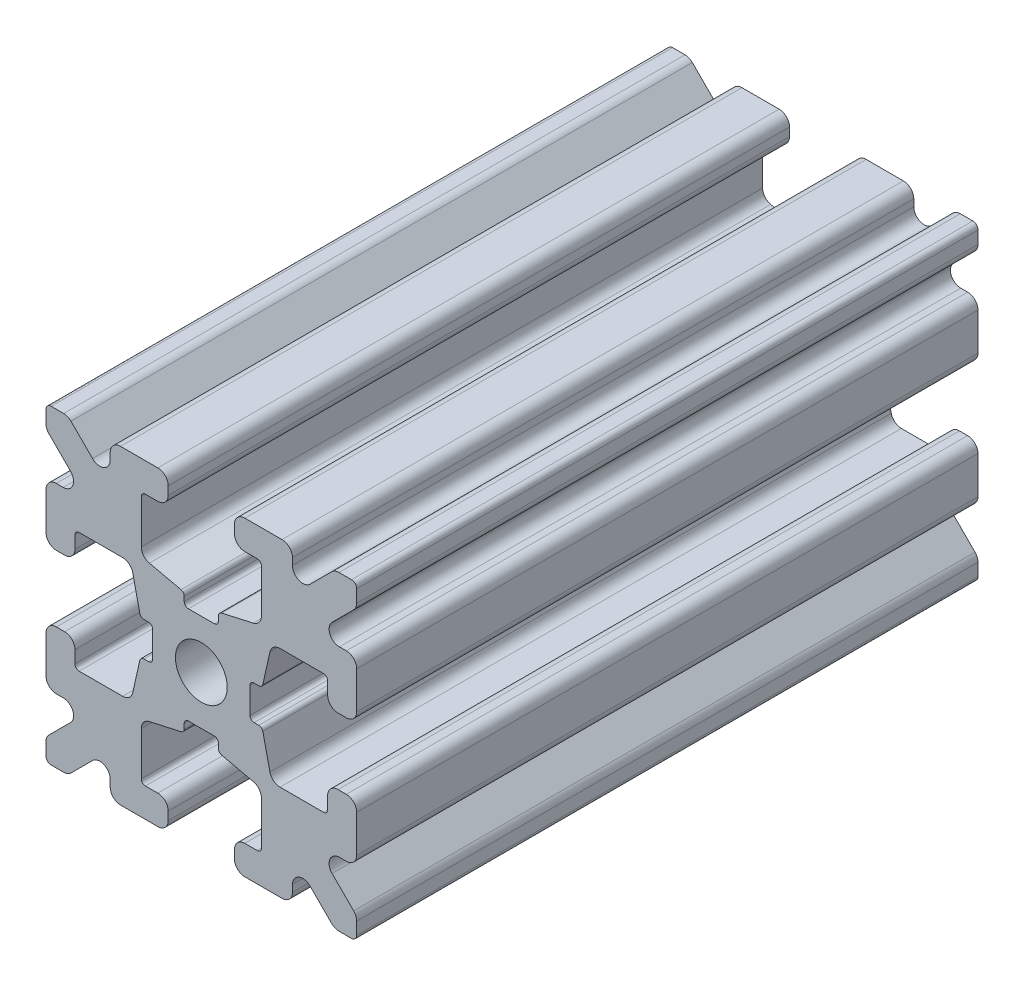
from build123d import *

# Parameters (mm, degrees)
SKETCH1_W           = 15
SKETCH1_H           = 15
SKETCH1_R           = 1.25
BOSS_EXTRUDE1_DEPTH = 15
FILLET1_R           = 0.25
CUT_EXTRUDE1_DEPTH  = 32.819805153
CUT_EXTRUDE3_DEPTH  = 32.819805153
FILLET3_R           = 0.5
FILLET4_R           = 0.5
FILLET5_R           = 3
FILLET6_R           = 0.2
CUT_EXTRUDE4_DEPTH  = 32.819805153
FILLET8_R           = 0.5
SKETCH6_W           = 5.1529354
SKETCH6_H           = 1.651
SKETCH6_W_2         = 1.651
SKETCH6_H_2         = 5.1529354
CUT_EXTRUDE5_DEPTH  = 32.819805153
FILLET10_R          = 0.2


with BuildPart() as part:
    # Sketch1 → Boss-Extrude1 (new, symmetric)
    with BuildSketch(Plane.XY):
        Rectangle(SKETCH1_W, SKETCH1_H)
        Circle(SKETCH1_R, mode=Mode.SUBTRACT)
    extrude(amount=BOSS_EXTRUDE1_DEPTH, both=True)

    # Fillet1
    fillet1_edges = [part.edges().sort_by_distance(p)[0] for p in [
        (7.5, -7.5, 0),
        (-7.5, -7.5, 0),
        (-7.5, 7.5, 0),
        (7.5, 7.5, 0),
    ]]
    fillet(fillet1_edges, radius=FILLET1_R)

    # Sketch2 → Cut-Extrude1 (cut, through all)
    with BuildSketch(Plane.XY.offset(15)):
        Polygon((-7.5, 1.6), (-6.1, 1.6), (-6.1, 2.9), (-3.4, 2.9), (-3.4, -2.9), (-6.1, -2.9), (-6.1, -1.6), (-7.5, -1.6), align=None)
        Polygon((2.9, 6.1), (1.6, 6.1), (1.6, 7.5), (-1.6, 7.5), (-1.6, 6.1), (-2.9, 6.1), (-2.9, 3.4), (2.9, 3.4), align=None)
        Polygon((-1.6, -7.5), (-1.6, -6.1), (-2.9, -6.1), (-2.9, -3.4), (2.9, -3.4), (2.9, -6.1), (1.6, -6.1), (1.6, -7.5), align=None)
        Polygon((6.1, -2.9), (6.1, -1.6), (7.5, -1.6), (7.5, 1.6), (6.1, 1.6), (6.1, 2.9), (3.4, 2.9), (3.4, -2.9), align=None)
    extrude(amount=-CUT_EXTRUDE1_DEPTH, mode=Mode.SUBTRACT)

    # Sketch4 → Cut-Extrude3 (cut, through all)
    with BuildSketch(Plane.XY.offset(15)):
        Polygon((-3.4, 2.9), (-2.75, 0), (-3.4, -2.9), align=None)
        Polygon((-2.9, 3.4), (0, 2.75), (2.9, 3.4), align=None)
        Polygon((3.4, 2.9), (2.75, 0), (3.4, -2.9), align=None)
        Polygon((-2.9, -3.4), (0, -2.75), (2.9, -3.4), align=None)
    extrude(amount=-CUT_EXTRUDE3_DEPTH, mode=Mode.SUBTRACT)

    # Fillet3
    fillet3_edges = [part.edges().sort_by_distance(p)[0] for p in [
        (1.6, -7.5, 0),
        (-1.6, -7.5, 0),
        (-1.6, -6.1, 0),
        (1.6, -6.1, 0),
        (6.1, 1.6, 0),
        (7.5, 1.6, 0),
        (7.5, -1.6, 0),
        (6.1, -1.6, 0),
        (-7.5, -1.6, 0),
        (-7.5, 1.6, 0),
        (-6.1, 1.6, 0),
        (-6.1, -1.6, 0),
        (-1.6, 6.1, 0),
        (-1.6, 7.5, 0),
        (1.6, 7.5, 0),
        (1.6, 6.1, 0),
    ]]
    fillet(fillet3_edges, radius=FILLET3_R)

    # Fillet4
    fillet4_edges = [part.edges().sort_by_distance(p)[0] for p in [
        (-2.9, -3.4, 0),
        (2.9, -3.4, 0),
        (3.4, -2.9, 0),
        (3.4, 2.9, 0),
        (-3.4, 2.9, 0),
        (-3.4, -2.9, 0),
        (2.9, 3.4, 0),
        (-2.9, 3.4, 0),
    ]]
    fillet(fillet4_edges, radius=FILLET4_R)

    # Fillet5
    fillet5_edges = [part.edges().sort_by_distance(p)[0] for p in [
        (-2.75, 0, 0),
        (0, 2.75, 0),
        (2.75, 0, 0),
        (0, -2.75, 0),
    ]]
    fillet(fillet5_edges, radius=FILLET5_R)

    # Fillet6
    fillet6_edges = [part.edges().sort_by_distance(p)[0] for p in [
        (-2.9, -6.1, 0),
        (2.9, -6.1, 0),
        (6.1, -2.9, 0),
        (6.1, 2.9, 0),
        (-6.1, 2.9, 0),
        (-6.1, -2.9, 0),
        (2.9, 6.1, 0),
        (-2.9, 6.1, 0),
    ]]
    fillet(fillet6_edges, radius=FILLET6_R)

    # Sketch5 → Cut-Extrude4 (cut, through all)
    with BuildSketch(Plane.XY.offset(15)):
        Polygon((-7.5, 6.439339828), (-5.460660172, 4.4), (-7.5, 4.4), align=None)
        Polygon((-6.439339828, 7.5), (-4.4, 5.460660172), (-4.4, 7.5), align=None)
        Polygon((4.4, 7.5), (6.439339828, 7.5), (4.4, 5.460660172), align=None)
        Polygon((7.5, 6.439339828), (7.5, 4.4), (5.460660172, 4.4), align=None)
        Polygon((7.5, -6.439339828), (5.460660172, -4.4), (7.5, -4.4), align=None)
        Polygon((6.439339828, -7.5), (4.4, -5.460660172), (4.4, -7.5), align=None)
        Polygon((-4.4, -7.5), (-6.439339828, -7.5), (-4.4, -5.460660172), align=None)
        Polygon((-7.5, -6.439339828), (-7.5, -4.4), (-5.460660172, -4.4), align=None)
    extrude(amount=-CUT_EXTRUDE4_DEPTH, mode=Mode.SUBTRACT)

    # Fillet8
    fillet8_edges = [part.edges().sort_by_distance(p)[0] for p in [
        (-7.5, 4.4, 0),
        (-7.5, 6.439339828, 0),
        (-5.460660172, 4.4, 0),
        (7.5, -4.4, 0),
        (7.5, -6.439339828, 0),
        (5.460660172, -4.4, 0),
        (5.460660172, 4.4, 0),
        (7.5, 6.439339828, 0),
        (7.5, 4.4, 0),
        (-4.4, 7.5, 0),
        (-4.4, 5.460660172, 0),
        (-6.439339828, 7.5, 0),
        (-5.460660172, -4.4, 0),
        (-7.5, -6.439339828, 0),
        (-7.5, -4.4, 0),
        (4.4, 5.460660172, 0),
        (4.4, 7.5, 0),
        (6.439339828, 7.5, 0),
        (6.439339828, -7.5, 0),
        (4.4, -7.5, 0),
        (4.4, -5.460660172, 0),
        (-6.439339828, -7.5, 0),
        (-4.4, -5.460660172, 0),
        (-4.4, -7.5, 0),
    ]]
    fillet(fillet8_edges, radius=FILLET8_R)

    # Sketch6 → Cut-Extrude5 (cut, through all)
    with BuildSketch(Plane.XY.offset(15)):
        with Locations((4.9235323, 0)):
            Rectangle(SKETCH6_W, SKETCH6_H)
        with Locations((0, -4.9235323)):
            Rectangle(SKETCH6_W_2, SKETCH6_H_2)
        with Locations((-4.9235323, 0)):
            Rectangle(SKETCH6_W, SKETCH6_H)
        with Locations((0, 4.9235323)):
            Rectangle(SKETCH6_W_2, SKETCH6_H_2)
    extrude(amount=-CUT_EXTRUDE5_DEPTH, mode=Mode.SUBTRACT)

    # Fillet10
    fillet10_edges = [part.edges().sort_by_distance(p)[0] for p in [
        (0.8255, -2.935025862, 0),
        (-0.8255, -2.935025862, 0),
        (0.8255, -2.3470646, 0),
        (-0.8255, -2.3470646, 0),
        (2.935025862, 0.8255, 0),
        (2.935025862, -0.8255, 0),
        (2.3470646, 0.8255, 0),
        (2.3470646, -0.8255, 0),
        (-2.935025862, -0.8255, 0),
        (-2.935025862, 0.8255, 0),
        (-2.3470646, -0.8255, 0),
        (-2.3470646, 0.8255, 0),
        (-0.8255, 2.935025862, 0),
        (0.8255, 2.935025862, 0),
        (-0.8255, 2.3470646, 0),
        (0.8255, 2.3470646, 0),
    ]]
    fillet(fillet10_edges, radius=FILLET10_R)


solid = part.part
